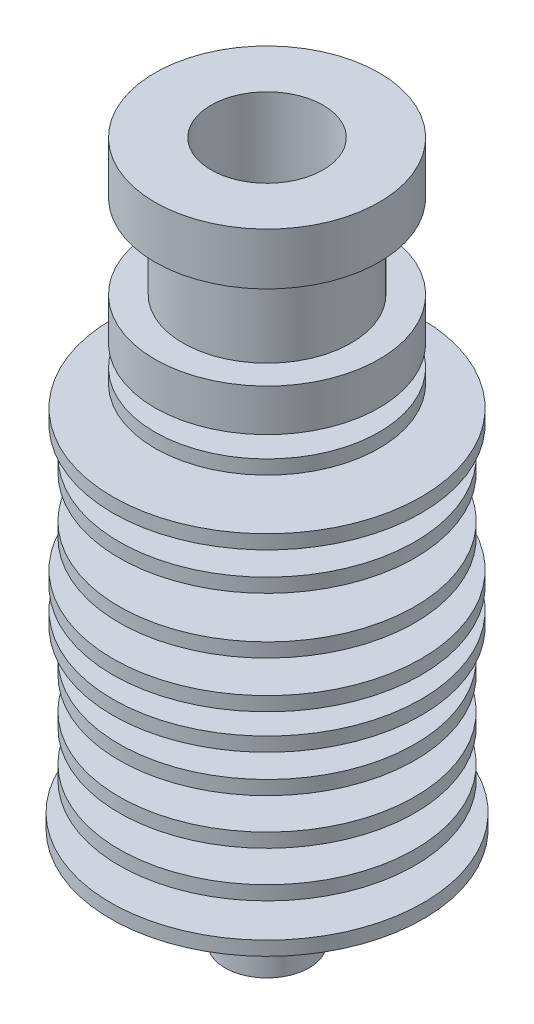
from build123d import *


with BuildPart() as part:
    # Skizze1 → Rotation1 (revolve)
    with BuildSketch(Plane.XY, mode=Mode.PRIVATE) as rotation1_sk:
        Polygon((4, 0), (8, 0), (8, -3.7), (6, -3.7), (6, -9.7), (8, -9.7), (8, -12.7), (4.5, -12.7), (4.5, -14.2), (8, -14.2), (8, -15.2), (4.5, -15.2), (4.5, -16.7), (11, -16.7), (11, -17.7), (3.5, -17.7), (3.5, -19.7), (10.55, -19.7), (10.55, -20.7), (3.05, -20.7), (3.05, -23.7), (10.55, -23.7), (10.55, -24.7), (3.5, -24.7), (3.5, -26.7), (11, -26.7), (11, -27.7), (7, -27.7), (7, -29.2), (11, -29.2), (11, -30.2), (3.5, -30.2), (3.5, -32.2), (10.55, -32.2), (10.55, -33.2), (3.05, -33.2), (3.05, -35.45), (10.55, -35.45), (10.55, -36.45), (3.05, -36.45), (3.05, -38.7), (10.55, -38.7), (10.55, -39.7), (3.65, -39.7), (3.65, -41.7), (11.15, -41.7), (11.15, -42.7), (2.75, -42.7), (2.75, -44.8), (3, -44.8), (3, -49.8), (2, -49.8), (2, -7.900415076), (4, -6.5), align=None)
    revolve(rotation1_sk.sketch.rotate(Axis((0, 0, 0), (0, 1, 0)), 90), axis=Axis((0, 0, 0), (0, 1, 0)))


solid = part.part
